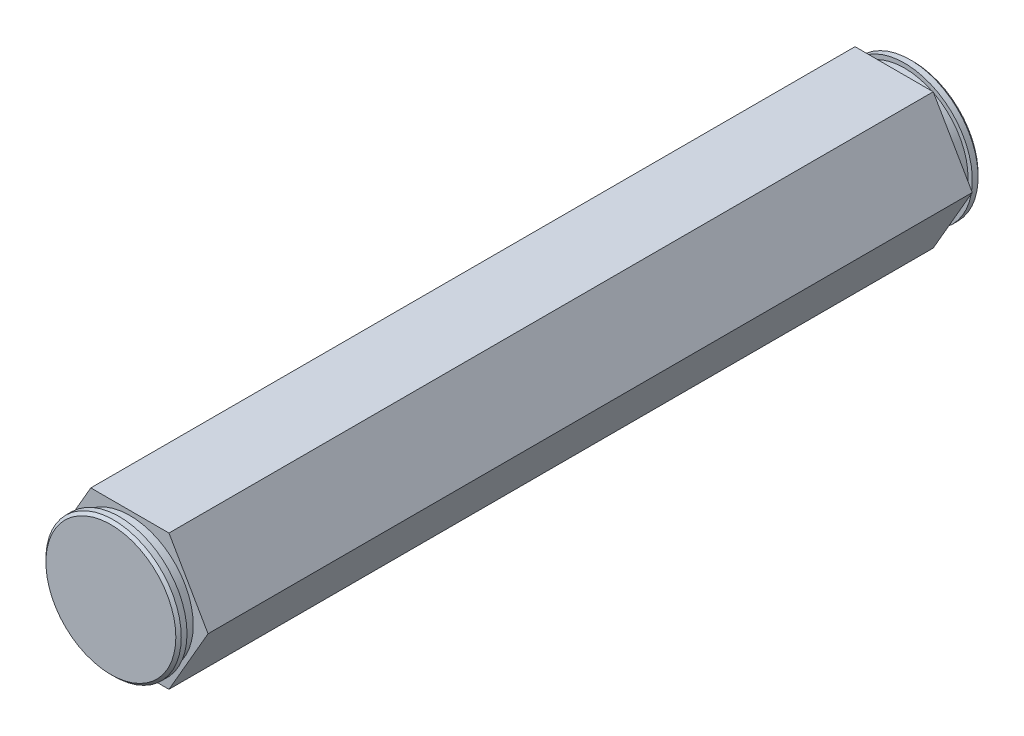
from build123d import *

# Parameters (mm, degrees)
BOSS_EXTRUDE1_DEPTH = 14.2875
SKETCH2_R           = 5.9436
BOSS_EXTRUDE2_DEPTH = 0.9906
SKETCH3_R           = 6.35
BOSS_EXTRUDE3_DEPTH = 0.79375
CHAMFER1_SIZE       = 0.254
SKETCH4_R           = 3.175
CUT_EXTRUDE1_DEPTH  = 12.7
BOSS_EXTRUDE4_DEPTH = 43.1165
BOSS_EXTRUDE5_START = 0.9906
SKETCH6_R           = 5.9436
BOSS_EXTRUDE5_DEPTH = 0.9906
BOSS_EXTRUDE6_START = 0.79375
SKETCH7_R           = 6.35
BOSS_EXTRUDE6_DEPTH = 0.79375
CHAMFER2_SIZE       = 0.254


with BuildPart() as part:
    # Sketch1 → Boss-Extrude1 (new, symmetric)
    with BuildSketch(Plane.XY):
        Polygon((7.332348419, 0), (3.666174209, 6.35), (-3.666174209, 6.35), (-7.332348419, 0), (-3.666174209, -6.35), (3.666174209, -6.35), align=None)
    extrude(amount=BOSS_EXTRUDE1_DEPTH, both=True)

    # Sketch2 → Boss-Extrude2 (add)
    with BuildSketch(Plane(origin=(0, 0, -14.2875), x_dir=(-1, 0, 0), z_dir=(0, 0, -1))):
        with Locations(Location((0, 0, 0), (0, 0, 180))):
            Circle(SKETCH2_R)
    extrude(amount=BOSS_EXTRUDE2_DEPTH)

    # Sketch3 → Boss-Extrude3 (add)
    with BuildSketch(Plane(origin=(0, 0, -15.2781), x_dir=(-1, 0, 0), z_dir=(0, 0, -1))):
        Circle(SKETCH3_R)
    extrude(amount=BOSS_EXTRUDE3_DEPTH)

    # Chamfer1
    chamfer1_edges = [part.edges().sort_by_distance(p)[0] for p in [
        (6.35, 0, -16.07185),
    ]]
    chamfer(chamfer1_edges, length=CHAMFER1_SIZE)

    # Sketch4 → Cut-Extrude1 (cut)
    with BuildSketch(Plane(origin=(0, 0, -16.07185), x_dir=(-1, 0, 0), z_dir=(0, 0, -1))):
        Circle(SKETCH4_R)
    extrude(amount=-CUT_EXTRUDE1_DEPTH, mode=Mode.SUBTRACT)

    # Sketch5 → Boss-Extrude4 (add)
    with BuildSketch(Plane.XY.offset(14.2875)):
        Polygon((3.666174209, 6.35), (-3.666174209, 6.35), (-7.332348419, 0), (-3.666174209, -6.35), (3.666174209, -6.35), (7.332348419, 0), align=None)
    extrude(amount=BOSS_EXTRUDE4_DEPTH)

    # Sketch6 → Boss-Extrude5 (add)
    with BuildSketch(Plane.XY.offset(57.404).offset(BOSS_EXTRUDE5_START)):
        Circle(SKETCH6_R)
    extrude(amount=-BOSS_EXTRUDE5_DEPTH)

    # Sketch7 → Boss-Extrude6 (add)
    with BuildSketch(Plane.XY.offset(58.3946).offset(BOSS_EXTRUDE6_START)):
        with Locations(Location((0, 0, 0), (0, 0, 180))):
            Circle(SKETCH7_R)
    extrude(amount=-BOSS_EXTRUDE6_DEPTH)

    # Chamfer2
    chamfer2_edges = [part.edges().sort_by_distance(p)[0] for p in [
        (6.35, 0, 59.18835),
    ]]
    chamfer(chamfer2_edges, length=CHAMFER2_SIZE)


solid = part.part
